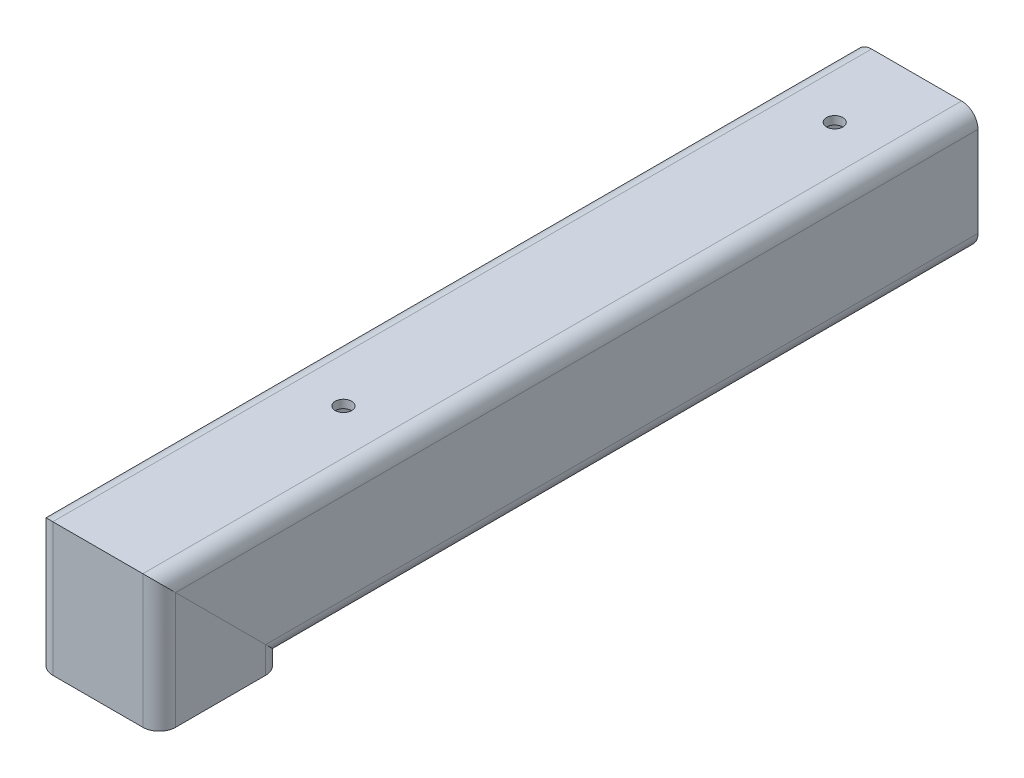
from build123d import *

# Parameters (mm, degrees)
EXTRUDE_1_DEPTH          = 32.5
CUT_EXTRUDE_1_DEPTH      = 39.810436741
CUT_EXTRUDE_1_DEPTH_BACK = 39.810436741
EXTRUDE_2_REACH          = 205.178
SKETCH_4_R               = 2
CUT_EXTRUDE_2_DEPTH      = 189.431021862


with BuildPart() as part:
    # 草图1 → 凸台-拉伸1 (new body)
    with BuildSketch(Plane(origin=(0, 0, 0), x_dir=(1, 0, 0), z_dir=(0, 1, 0))):
        with BuildLine():
            Line((-11, -15), (11, -15))
            ThreePointArc((11, -15), (13.828427125, -13.828427125), (15, -11))
            Line((15, -11), (15, 11))
            ThreePointArc((15, 11), (13.828427125, 13.828427125), (11, 15))
            Line((11, 15), (-11, 15))
            ThreePointArc((-11, 15), (-13.828427125, 13.828427125), (-15, 11))
            Line((-15, 11), (-15, -11))
            ThreePointArc((-15, -11), (-13.828427125, -13.828427125), (-11, -15))
        make_face()
        with BuildLine():
            Line((-11, -13), (11, -13))
            ThreePointArc((11, -13), (12.414213562, -12.414213562), (13, -11))
            Line((13, -11), (13, 11))
            ThreePointArc((13, 11), (12.414213562, 12.414213562), (11, 13))
            Line((11, 13), (-11, 13))
            ThreePointArc((-11, 13), (-12.414213562, 12.414213562), (-13, 11))
            Line((-13, 11), (-13, -11))
            ThreePointArc((-13, -11), (-12.414213562, -12.414213562), (-11, -13))
        make_face(mode=Mode.SUBTRACT)
    extrude(amount=EXTRUDE_1_DEPTH)

    # 草图2 → 切除-拉伸1 (cut, two sides: drawn at the far end of the back side and taken through both)
    with BuildSketch(Plane(origin=(0, 0, 0), x_dir=(0, 0, -1), z_dir=(1, 0, 0)).offset(-CUT_EXTRUDE_1_DEPTH_BACK)):
        Polygon((-15, 32.5), (15, 32.5), (15, 2.5), align=None)
    extrude(amount=CUT_EXTRUDE_1_DEPTH + CUT_EXTRUDE_1_DEPTH_BACK, mode=Mode.SUBTRACT)


with BuildPart() as body_2:
    # 凸台-拉伸2: up to this plane
    extrude_2_end = Plane(origin=(-15, 2.5, -15), z_dir=(0, -0.7071067811865513, 0.7071067811865438))
    # 草图3 → 凸台-拉伸2 (new, up to the surface)
    with BuildSketch(Plane.XY.offset(-185), mode=Mode.PRIVATE) as extrude_2_sk1:
        with BuildLine():
            Line((-11, 2.5), (11, 2.5))
            ThreePointArc((11, 2.5), (13.828427125, 3.671572875), (15, 6.5))
            Line((15, 6.5), (15, 28.5))
            ThreePointArc((15, 28.5), (13.828427125, 31.328427125), (11, 32.5))
            Line((11, 32.5), (-11, 32.5))
            ThreePointArc((-11, 32.5), (-13.828427125, 31.328427125), (-15, 28.5))
            Line((-15, 28.5), (-15, 6.5))
            ThreePointArc((-15, 6.5), (-13.828427125, 3.671572875), (-11, 2.5))
        make_face()
        with BuildLine():
            Line((-11, 4.5), (11, 4.5))
            ThreePointArc((11, 4.5), (12.414213562, 5.085786438), (13, 6.5))
            Line((13, 6.5), (13, 28.5))
            ThreePointArc((13, 28.5), (12.414213562, 29.914213562), (11, 30.5))
            Line((11, 30.5), (-11, 30.5))
            ThreePointArc((-11, 30.5), (-12.414213562, 29.914213562), (-13, 28.5))
            Line((-13, 28.5), (-13, 6.5))
            ThreePointArc((-13, 6.5), (-12.414213562, 5.085786438), (-11, 4.5))
        make_face(mode=Mode.SUBTRACT)
    extrude_2_tool1 = split(extrude(extrude_2_sk1.sketch, amount=EXTRUDE_2_REACH, mode=Mode.PRIVATE), bisect_by=extrude_2_end, keep=Keep.BOTH, mode=Mode.PRIVATE)
    add(extrude_2_tool1.solids().sort_by_distance((0, 2.924264, -185))[0])

    # 草图4 → 切除-拉伸2 (cut, through all)
    with BuildSketch(Plane(origin=(0, 0, 0), x_dir=(1, 0, 0), z_dir=(0, 1, 0))):
        with Locations(Location((0, 165, 0), (0, 0, 270))):
            Circle(SKETCH_4_R)
        with Locations(Location((0, 45, 0), (0, 0, 270))):
            Circle(SKETCH_4_R)
    extrude(amount=CUT_EXTRUDE_2_DEPTH, mode=Mode.SUBTRACT)


solid = Compound([part.part, body_2.part])
